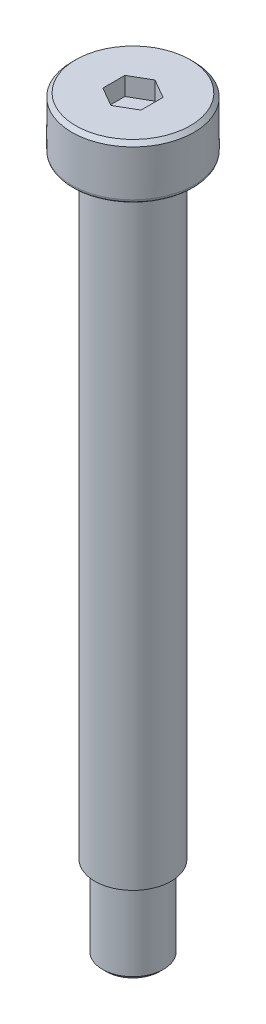
from build123d import *

# Parameters (mm, degrees)
CUT_EXTRUDE1_DEPTH = 2.4
CHAMFER1_SIZE      = 0.5
FILLET1_R          = 0.5
CHAMFER2_SIZE      = 0.5


with BuildPart() as part:
    # Sketch1 → Revolve1 (revolve)
    with BuildSketch(Plane.XY, mode=Mode.PRIVATE) as revolve1_sk:
        Polygon((0, 0), (8, 0), (8, -7), (4.75, -7), (4.75, -7.5), (5, -7.5), (5, -87), (4, -87), (4, -98), (0, -98), align=None)
    revolve(revolve1_sk.sketch.rotate(Axis((0, 5, 0), (0, -1, 0)), 180), axis=Axis((0, 5, 0), (0, -1, 0)))

    # Sketch2 → Cut-Extrude1 (cut)
    with BuildSketch(Plane(origin=(0, 0, 0), x_dir=(1, 0, 0), z_dir=(0, 1, 0))):
        Polygon((0, -2.886751346), (2.5, -1.443375673), (2.5, 1.443375673), (0, 2.886751346), (-2.5, 1.443375673), (-2.5, -1.443375673), align=None)
    extrude(amount=-CUT_EXTRUDE1_DEPTH, mode=Mode.SUBTRACT)

    # Chamfer1
    chamfer1_edges = [part.edges().sort_by_distance(p)[0] for p in [
        (8, 0, 0),
    ]]
    chamfer(chamfer1_edges, length=CHAMFER1_SIZE)

    # Fillet1
    fillet1_edges = [part.edges().sort_by_distance(p)[0] for p in [
        (8, -7, 0),
    ]]
    fillet(fillet1_edges, radius=FILLET1_R)

    # Chamfer2
    chamfer2_edges = [part.edges().sort_by_distance(p)[0] for p in [
        (4, -98, 0),
    ]]
    chamfer(chamfer2_edges, length=CHAMFER2_SIZE)


solid = part.part
